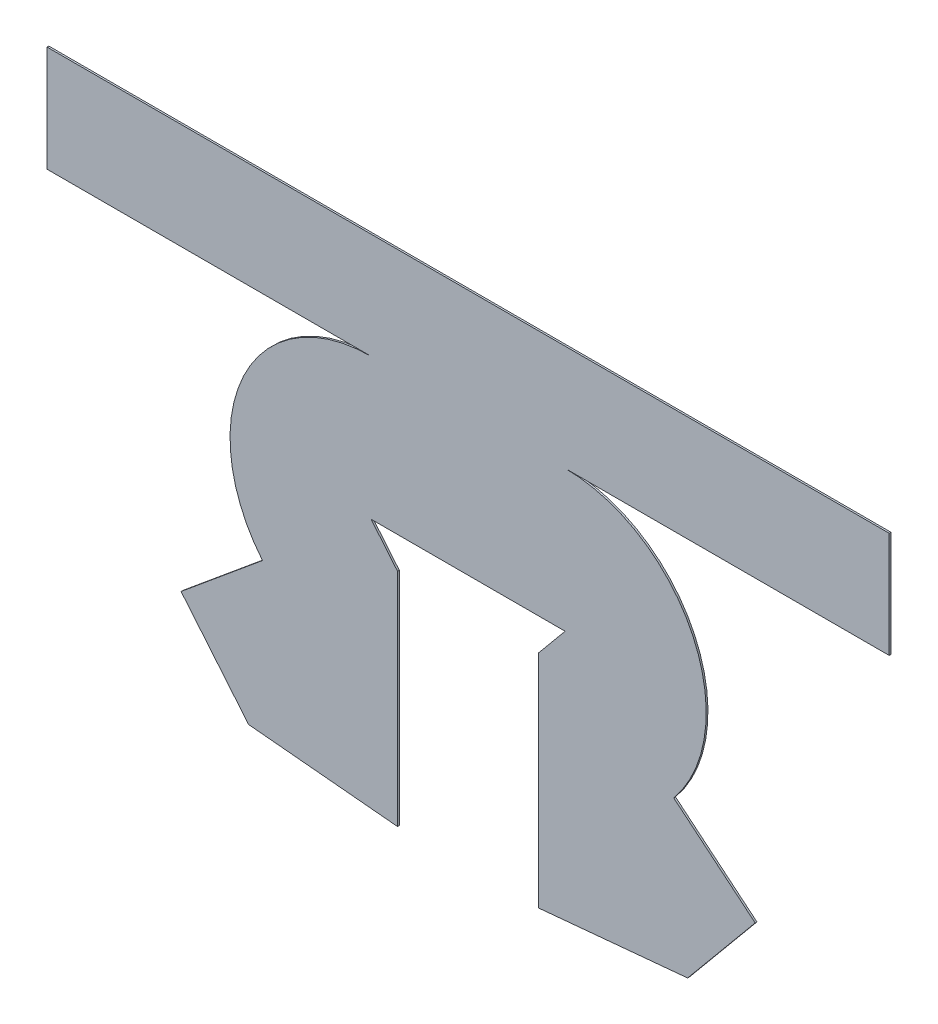
from build123d import *

# Parameters (mm, degrees)
BOSS_EXTRUDE2_DEPTH = 2.54


with BuildPart() as part:
    # Sketch1 → Boss-Extrude2 (new body)
    with BuildSketch(Plane.XY):
        Polygon((280.770009641, 372.365015451), (280.770009641, 169.165015451), (242.670009641, 169.165015451), (39.470009641, 169.165015451), (1.370009641, 169.165015451), (1.370009641, 372.365015451), align=None)
        Polygon((280.770009641, 372.365015451), (747.609563641, 372.365015451), (747.609563641, 524.765015451), (280.770009641, 524.765015451), (-24.029990359, 524.765015451), (-465.469544359, 524.765015451), (-465.469544359, 372.365015451), (1.370009641, 372.365015451), align=None)
        with BuildLine():
            Line((1.370009641, 372.365015451), (1.370009641, 169.165015451))
            Line((1.370009641, 169.165015451), (39.470009641, 123.208075057))
            Line((39.470009641, 123.208075057), (39.470009641, -195.172287059))
            Line((39.470009641, -195.172287059), (-155.062591517, 39.476614679))
            ThreePointArc((-155.062591517, 39.476614679), (-182.536111841, 255.58711032), (1.370009641, 372.365015451))
        make_face()
        with BuildLine():
            ThreePointArc((280.770009641, 372.365015451), (464.676131123, 255.58711032), (437.202610799, 39.476614679))
            Line((437.202610799, 39.476614679), (242.670009641, -195.172287059))
            Line((242.670009641, -195.172287059), (242.670009641, 123.208075057))
            Line((242.670009641, 123.208075057), (280.770009641, 169.165015451))
            Line((280.770009641, 169.165015451), (280.770009641, 372.365015451))
        make_face()
        Polygon((554.527061668, -57.7896859), (457.260761089, -175.114136769), (242.670009641, -195.172287059), (437.202610799, 39.476614679), align=None)
        Polygon((-272.387042386, -57.7896859), (-155.062591517, 39.476614679), (39.470009641, -195.172287059), (-175.120741807, -175.114136769), align=None)
    extrude(amount=BOSS_EXTRUDE2_DEPTH)


solid = part.part
